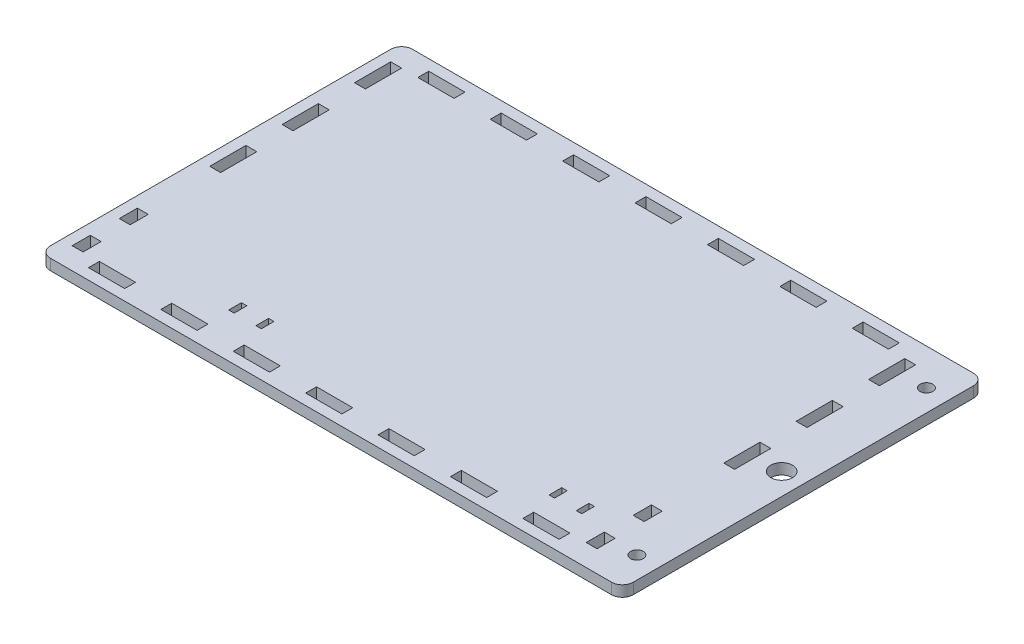
from build123d import *

# Parameters (mm, degrees)
SKETCH1_W           = 151
SKETCH1_H           = 100
BOSS_EXTRUDE1_DEPTH = 3
SKETCH3_W           = 1.5
SKETCH3_H           = 3.5
CUT_EXTRUDE1_DEPTH  = 182.13530854
SKETCH4_W           = 10
SKETCH4_H           = 100
BOSS_EXTRUDE2_DEPTH = 3
SKETCH5_R           = 3
SKETCH5_R_2         = 1.75
CUT_EXTRUDE2_DEPTH  = 190.552103655
FILLET1_R           = 3
FILLET2_R           = 3
SKETCH6_W           = 3
SKETCH6_H           = 5
SKETCH6_H_2         = 10
SKETCH6_W_2         = 10
SKETCH6_H_3         = 3
CUT_EXTRUDE3_DEPTH  = 190.552103655


with BuildPart() as part:
    # Sketch1 → Boss-Extrude1 (new body)
    with BuildSketch(Plane(origin=(0, 0, 0), x_dir=(1, 0, 0), z_dir=(0, 1, 0))):
        with Locations((75.5, -50)):
            Rectangle(SKETCH1_W, SKETCH1_H)
    extrude(amount=BOSS_EXTRUDE1_DEPTH)

    # Sketch3 → Cut-Extrude1 (cut, through all)
    with BuildSketch(Plane.XZ):
        with Locations((40.75, 86)):
            Rectangle(SKETCH3_W, SKETCH3_H)
        with Locations((48.25, 86)):
            Rectangle(SKETCH3_W, SKETCH3_H)
        with Locations((129.25, 86)):
            Rectangle(SKETCH3_W, SKETCH3_H)
        with Locations((136.75, 86)):
            Rectangle(SKETCH3_W, SKETCH3_H)
    extrude(amount=-CUT_EXTRUDE1_DEPTH, mode=Mode.SUBTRACT)

    # Sketch4 → Boss-Extrude2 (add, through all)
    with BuildSketch(Plane.XZ):
        with Locations((156, 50)):
            Rectangle(SKETCH4_W, SKETCH4_H)
    extrude(amount=-BOSS_EXTRUDE2_DEPTH)

    # Sketch5 → Cut-Extrude2 (cut, through all)
    with BuildSketch(Plane.XZ):
        with Locations(Location((155, 50, 0), (0, 0, 270))):
            Circle(SKETCH5_R)
        with Locations(Location((155, 90, 0), (0, 0, 270))):
            Circle(SKETCH5_R_2)
        with Locations(Location((155, 10, 0), (0, 0, 270))):
            Circle(SKETCH5_R_2)
    extrude(amount=-CUT_EXTRUDE2_DEPTH, mode=Mode.SUBTRACT)

    # Fillet1
    fillet1_edges = [part.edges().sort_by_distance(p)[0] for p in [
        (0, 1.5, 0),
        (0, 1.5, 100),
    ]]
    fillet(fillet1_edges, radius=FILLET1_R)

    # Fillet2
    fillet2_edges = [part.edges().sort_by_distance(p)[0] for p in [
        (161, 1.5, 100),
        (161, 1.5, 0),
    ]]
    fillet(fillet2_edges, radius=FILLET2_R)

    # Sketch6 → Cut-Extrude3 (cut, through all)
    with BuildSketch(Plane(origin=(0, 3, 0), x_dir=(1, 0, 0), z_dir=(0, 1, 0))):
        with Locations((146.5, -91.5)):
            Rectangle(SKETCH6_W, SKETCH6_H)
        with Locations((146.5, -78.5)):
            Rectangle(SKETCH6_W, SKETCH6_H)
        with Locations((146.5, -51)):
            Rectangle(SKETCH6_W, SKETCH6_H_2)
        with Locations((146.5, -31)):
            Rectangle(SKETCH6_W, SKETCH6_H_2)
        with Locations((146.5, -11)):
            Rectangle(SKETCH6_W, SKETCH6_H_2)
        with Locations((135.5, -4.5)):
            Rectangle(SKETCH6_W_2, SKETCH6_H_3)
        with Locations((115.5, -4.5)):
            Rectangle(SKETCH6_W_2, SKETCH6_H_3)
        with Locations((95.5, -4.5)):
            Rectangle(SKETCH6_W_2, SKETCH6_H_3)
        with Locations((75.5, -4.5)):
            Rectangle(SKETCH6_W_2, SKETCH6_H_3)
        with Locations((55.5, -4.5)):
            Rectangle(SKETCH6_W_2, SKETCH6_H_3)
        with Locations((35.5, -4.5)):
            Rectangle(SKETCH6_W_2, SKETCH6_H_3)
        with Locations((15.5, -4.5)):
            Rectangle(SKETCH6_W_2, SKETCH6_H_3)
        with Locations((4.5, -11)):
            Rectangle(SKETCH6_W, SKETCH6_H_2)
        with Locations((4.5, -31)):
            Rectangle(SKETCH6_W, SKETCH6_H_2)
        with Locations((4.5, -51)):
            Rectangle(SKETCH6_W, SKETCH6_H_2)
        with Locations((4.5, -78.5)):
            Rectangle(SKETCH6_W, SKETCH6_H)
        with Locations((4.5, -91.5)):
            Rectangle(SKETCH6_W, SKETCH6_H)
        with Locations((15.5, -95.5)):
            Rectangle(SKETCH6_W_2, SKETCH6_H_3)
        with Locations((35.5, -95.5)):
            Rectangle(SKETCH6_W_2, SKETCH6_H_3)
        with Locations((55.5, -95.5)):
            Rectangle(SKETCH6_W_2, SKETCH6_H_3)
        with Locations((75.5, -95.5)):
            Rectangle(SKETCH6_W_2, SKETCH6_H_3)
        with Locations((95.5, -95.5)):
            Rectangle(SKETCH6_W_2, SKETCH6_H_3)
        with Locations((115.5, -95.5)):
            Rectangle(SKETCH6_W_2, SKETCH6_H_3)
        with Locations((135.5, -95.5)):
            Rectangle(SKETCH6_W_2, SKETCH6_H_3)
    extrude(amount=-CUT_EXTRUDE3_DEPTH, mode=Mode.SUBTRACT)


solid = part.part
